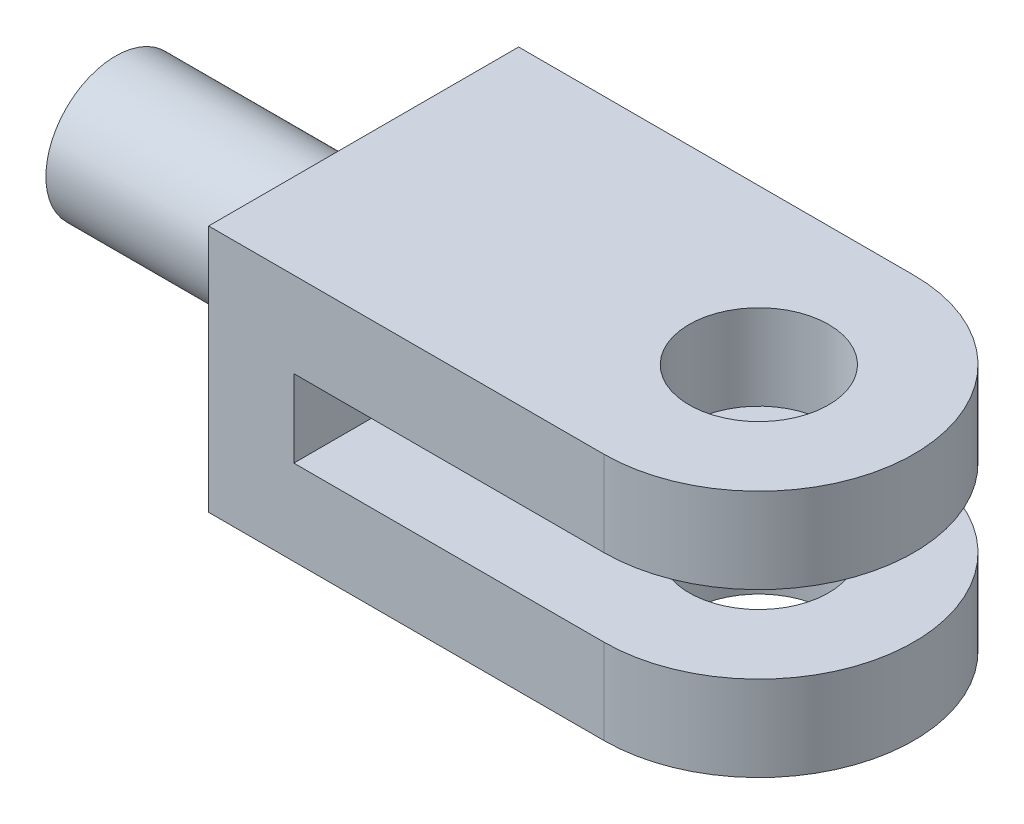
from build123d import *

# Parameters (mm, degrees)
SKETCH1_R           = 9
BOSS_EXTRUDE1_DEPTH = 32
SKETCH2_W           = 40
SKETCH2_H           = 32
BOSS_EXTRUDE2_DEPTH = 11
SKETCH3_R           = 9
BOSS_EXTRUDE5_DEPTH = 11
LPATTERN1_COUNT     = 2
LPATTERN1_PITCH     = 21


with BuildPart() as part:
    # Sketch1 → Boss-Extrude1 (new body)
    with BuildSketch(Plane(origin=(0, 0, 0), x_dir=(0, 0, -1), z_dir=(1, 0, 0))):
        Circle(SKETCH1_R)
    extrude(amount=BOSS_EXTRUDE1_DEPTH)

    # Sketch2 → Boss-Extrude2 (add)
    with BuildSketch(Plane(origin=(32, 0, 0), x_dir=(0, 0, -1), z_dir=(1, 0, 0))):
        Rectangle(SKETCH2_W, SKETCH2_H)
    extrude(amount=BOSS_EXTRUDE2_DEPTH)

    # Sketch3 → Boss-Extrude5 (add)
    with BuildSketch(Plane(origin=(0, -16, 0), x_dir=(-1, 0, 0), z_dir=(0, -1, 0))):
        with BuildLine():
            Line((-43, 20), (-83, 20))
            ThreePointArc((-83, 20), (-103, 0), (-83, -20))
            Line((-83, -20), (-43, -20))
            Line((-43, -20), (-43, 20))
        make_face()
        with Locations(Location((-83, 0, 0), (0, 0, 90))):
            Circle(SKETCH3_R, mode=Mode.SUBTRACT)
    boss_extrude5 = extrude(amount=-BOSS_EXTRUDE5_DEPTH)

    # LPattern1: Boss-Extrude5 ×2
    with Locations(*[(0, i * LPATTERN1_PITCH, 0) for i in range(1, LPATTERN1_COUNT)]):
        add(boss_extrude5)


solid = part.part
